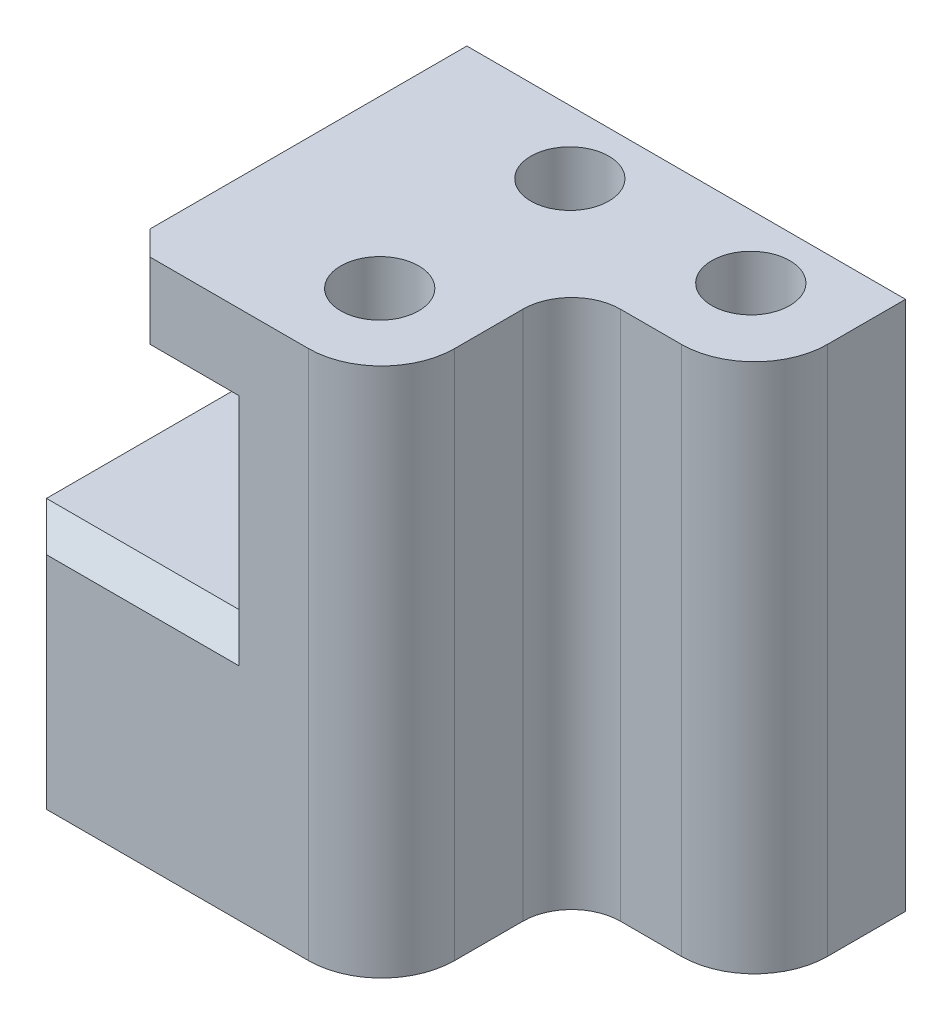
from build123d import *

# Parameters (mm, degrees)
RESSALTO_EXTRUS_O1_DEPTH = 15
CORTE_EXTRUS_O1_REACH    = 32.259
ESBO_O2_R                = 1.6
ESBO_O3_W                = 7.5
ESBO_O3_H                = 7.2
ESBO_O3_R                = 1.6
RESSALTO_EXTRUS_O2_DEPTH = 21.75
FILETE1_R                = 2
FILETE2_R                = 3
CHANFRO1_SIZE            = 1
CHANFRO2_SIZE            = 1


with BuildPart() as part:
    # Esboço1 → Ressalto-extrusão1 (new body)
    with BuildSketch(Plane.XY):
        Polygon((0, 0), (0, 21.75), (-10.5, 21.75), (-10.5, 17.65), (-6.85, 17.65), (-6.85, 10.05), (-14.75, 10.05), (-14.75, 0), align=None)
    extrude(amount=RESSALTO_EXTRUS_O1_DEPTH)

    # Esboço2 → Corte-extrusão1 (cut, up to next)
    with BuildSketch(Plane(origin=(0, 21.75, 0), x_dir=(1, 0, 0), z_dir=(0, 1, 0)), mode=Mode.PRIVATE) as corte_extrus_o1_sk1:
        with Locations(Location((-3.675, -3.6, 0), (0, 0, 180))):
            Circle(ESBO_O2_R)
    corte_extrus_o1_tool1 = extrude(corte_extrus_o1_sk1.sketch, amount=-CORTE_EXTRUS_O1_REACH, mode=Mode.PRIVATE) & part.part
    # Esboço2 → Corte-extrusão1 (cut, up to next)
    with BuildSketch(Plane(origin=(0, 21.75, 0), x_dir=(1, 0, 0), z_dir=(0, 1, 0)), mode=Mode.PRIVATE) as corte_extrus_o1_sk2:
        with Locations(Location((-3.675, -11.4, 0), (0, 0, 180))):
            Circle(ESBO_O2_R)
    corte_extrus_o1_tool2 = extrude(corte_extrus_o1_sk2.sketch, amount=-CORTE_EXTRUS_O1_REACH, mode=Mode.PRIVATE) & part.part
    add(corte_extrus_o1_tool1.solids().sort_by_distance((-3.675, 21.75, 3.6))[0], mode=Mode.SUBTRACT)
    add(corte_extrus_o1_tool2.solids().sort_by_distance((-3.675, 21.75, 11.4))[0], mode=Mode.SUBTRACT)

    # Esboço3 → Ressalto-extrusão2 (add)
    with BuildSketch(Plane(origin=(0, 21.75, 0), x_dir=(1, 0, 0), z_dir=(0, 1, 0))):
        with Locations((3.75, -3.6)):
            Rectangle(ESBO_O3_W, ESBO_O3_H)
        with Locations(Location((3.75, -3.6, 0), (0, 0, 180))):
            Circle(ESBO_O3_R, mode=Mode.SUBTRACT)
    extrude(amount=-RESSALTO_EXTRUS_O2_DEPTH)

    # Filete1
    filete1_edges = [part.edges().sort_by_distance(p)[0] for p in [
        (0, 10.875, 7.2),
    ]]
    fillet(filete1_edges, radius=FILETE1_R)

    # Filete2
    filete2_edges = [part.edges().sort_by_distance(p)[0] for p in [
        (7.5, 10.875, 7.2),
        (0, 10.875, 15),
    ]]
    fillet(filete2_edges, radius=FILETE2_R)

    # Chanfro1
    chanfro1_edges = [part.edges().sort_by_distance(p)[0] for p in [
        (-3.625, 0, 0),
        (7.5, 10.875, 0),
        (-14.75, 5.025, 0),
        (-10.8, 10.05, 0),
        (-6.85, 13.85, 0),
        (-8.675, 17.65, 0),
        (-10.5, 19.7, 0),
        (-1.5, 21.75, 0),
    ]]
    chamfer(chanfro1_edges, length=CHANFRO1_SIZE)

    # Chanfro2
    chanfro2_edges = [part.edges().sort_by_distance(p)[0] for p in [
        (-10.5, 19.7, 15),
        (-8.675, 17.65, 15),
        (-6.85, 13.85, 15),
        (-10.8, 10.05, 15),
        (-14.75, 5.025, 15),
    ]]
    chamfer(chanfro2_edges, length=CHANFRO2_SIZE)


solid = part.part
